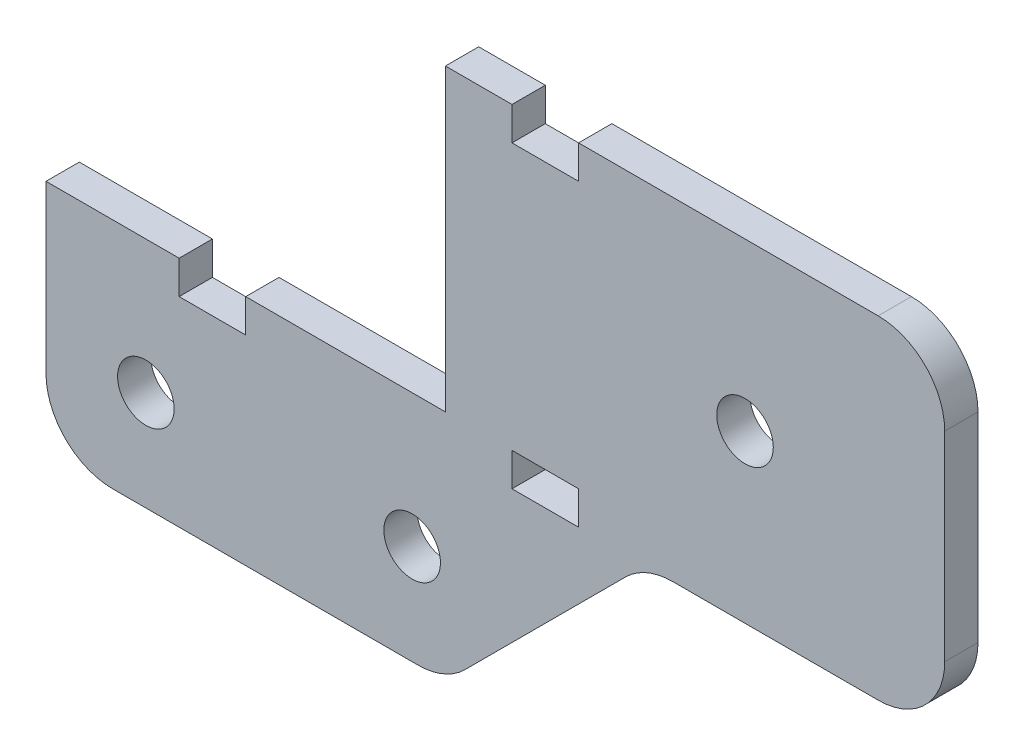
from build123d import *

# Parameters (mm, degrees)
SKETCH1_W           = 5
SKETCH1_H           = 10
BOSS_EXTRUDE1_DEPTH = 2.5
FILLET1_R           = 10
CUT_EXTRUDE1_REACH  = 125.085
SKETCH2_R           = 4.25


with BuildPart() as part:
    # Sketch1 → Boss-Extrude1 (new, symmetric)
    with BuildSketch(Plane(origin=(0, 0, 0), x_dir=(0, 1, 0), z_dir=(0, 0, 1))):
        Polygon((-55, 50), (-25, 20), (-25, -25), (25, -25), (25, 30), (20, 30), (20, 40), (25, 40), (25, 50), (-20, 50), (-20, 80), (-25, 80), (-25, 90), (-20, 90), (-20, 110), (-55, 110), align=None)
        with Locations((-22.5, 35)):
            Rectangle(SKETCH1_W, SKETCH1_H, mode=Mode.SUBTRACT)
    extrude(amount=BOSS_EXTRUDE1_DEPTH, both=True)

    # Fillet1
    fillet1_edges = [part.edges().sort_by_distance(p)[0] for p in [
        (-50, -55, 0),
        (-110, -55, 0),
        (25, 25, 0),
        (25, -25, 0),
        (-20, -25, 0),
    ]]
    fillet(fillet1_edges, radius=FILLET1_R)

    # Sketch2 → Cut-Extrude1 (cut, up to next)
    with BuildSketch(Plane.XY.offset(2.5), mode=Mode.PRIVATE) as cut_extrude1_sk1:
        with Locations((-95, -40)):
            Circle(SKETCH2_R)
    cut_extrude1_tool1 = extrude(cut_extrude1_sk1.sketch, amount=-CUT_EXTRUDE1_REACH, mode=Mode.PRIVATE) & part.part
    # Sketch2 → Cut-Extrude1 (cut, up to next)
    with BuildSketch(Plane.XY.offset(2.5), mode=Mode.PRIVATE) as cut_extrude1_sk2:
        with Locations((-55, -40)):
            Circle(SKETCH2_R)
    cut_extrude1_tool2 = extrude(cut_extrude1_sk2.sketch, amount=-CUT_EXTRUDE1_REACH, mode=Mode.PRIVATE) & part.part
    # Sketch2 → Cut-Extrude1 (cut, up to next)
    with BuildSketch(Plane.XY.offset(2.5), mode=Mode.PRIVATE) as cut_extrude1_sk3:
        with Locations((-5, 0)):
            Circle(SKETCH2_R)
    cut_extrude1_tool3 = extrude(cut_extrude1_sk3.sketch, amount=-CUT_EXTRUDE1_REACH, mode=Mode.PRIVATE) & part.part
    add(cut_extrude1_tool1.solids().sort_by_distance((-95, -40, 2.5))[0], mode=Mode.SUBTRACT)
    add(cut_extrude1_tool2.solids().sort_by_distance((-55, -40, 2.5))[0], mode=Mode.SUBTRACT)
    add(cut_extrude1_tool3.solids().sort_by_distance((-5, 0, 2.5))[0], mode=Mode.SUBTRACT)


solid = part.part
